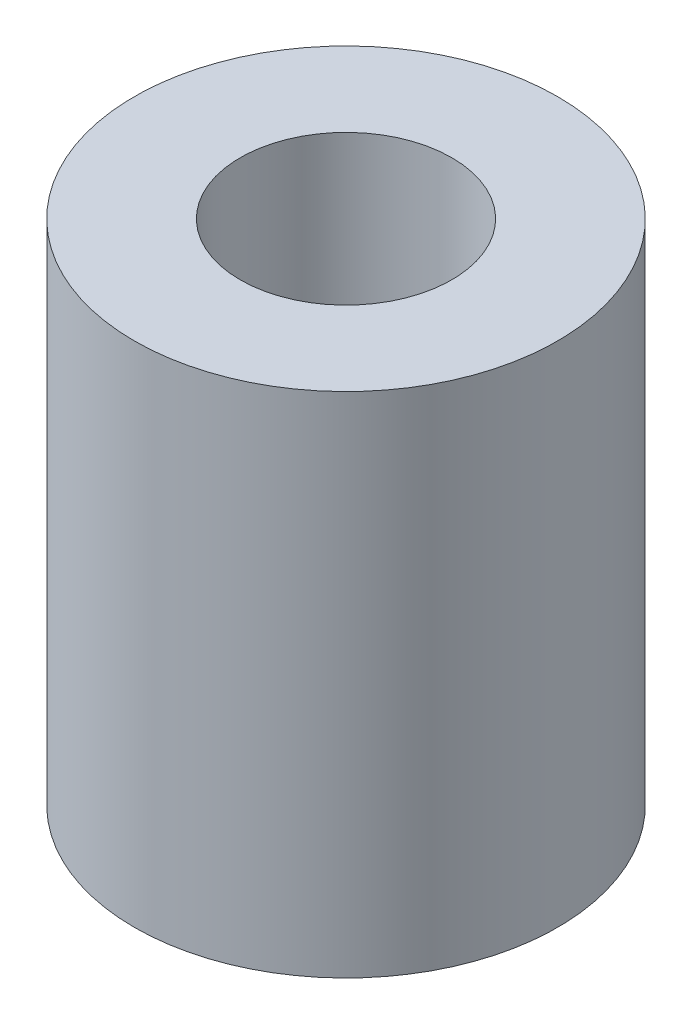
from build123d import *

# Parameters (mm, degrees)
SKETCH1_R             = 2.5
BOSS_EXTRUDE1_DEPTH   = 6
F_2_5MM_DOWEL_HOLE1_D = 2.5


with BuildPart() as part:
    # Sketch1 → Boss-Extrude1 (new body)
    with BuildSketch(Plane(origin=(0, 0, 0), x_dir=(1, 0, 0), z_dir=(0, 1, 0))):
        with Locations(Location((0, 0, 0), (0, 0, 270))):
            Circle(SKETCH1_R)
    extrude(amount=BOSS_EXTRUDE1_DEPTH)

    # Ø2.5mm Dowel Hole1 (through all)
    with Locations(Plane.ZX.offset(6)):
        with Locations((0, 0)):
            Hole(F_2_5MM_DOWEL_HOLE1_D / 2)


solid = part.part
